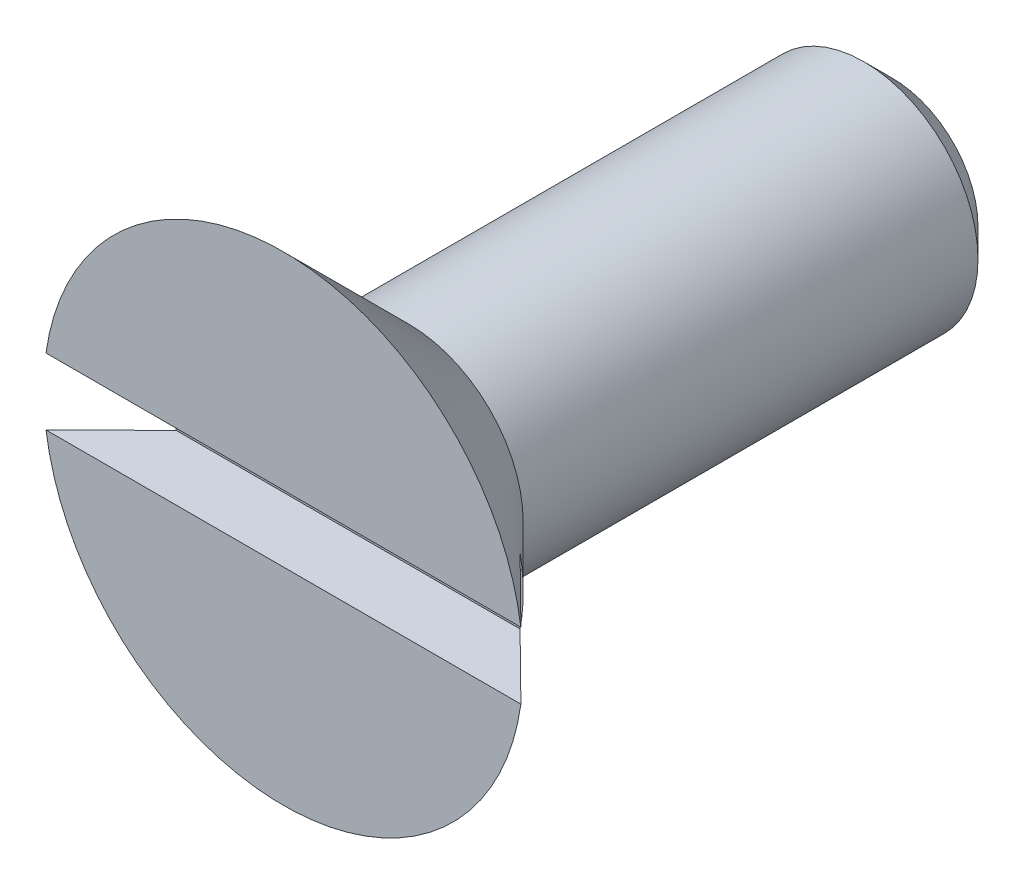
from build123d import *

# Parameters (mm, degrees)
SKETCH9_W          = 6.3
SKETCH9_H          = 0.875
CUT_EXTRUDE1_DEPTH = 0.85


with BuildPart() as part:
    # Sketch3 → Revolve1 (revolve)
    with BuildSketch(Plane(origin=(0, 0, 0), x_dir=(0, 0, -1), z_dir=(1, 0, 0))):
        Polygon((-1.7, 3.15), (-0.05, 1.5), (5.925, 1.5), (6.3, 1.125), (6.3, 0), (-1.7, 0), align=None)
    revolve(axis=Axis((0, 0, 1.7), (0, 0, -1)))

    # Sketch9 → Cut-Extrude1 (cut)
    with BuildSketch(Plane.XY.offset(1.7)):
        Rectangle(SKETCH9_W, SKETCH9_H)
    extrude(amount=-CUT_EXTRUDE1_DEPTH, mode=Mode.SUBTRACT)


solid = part.part
